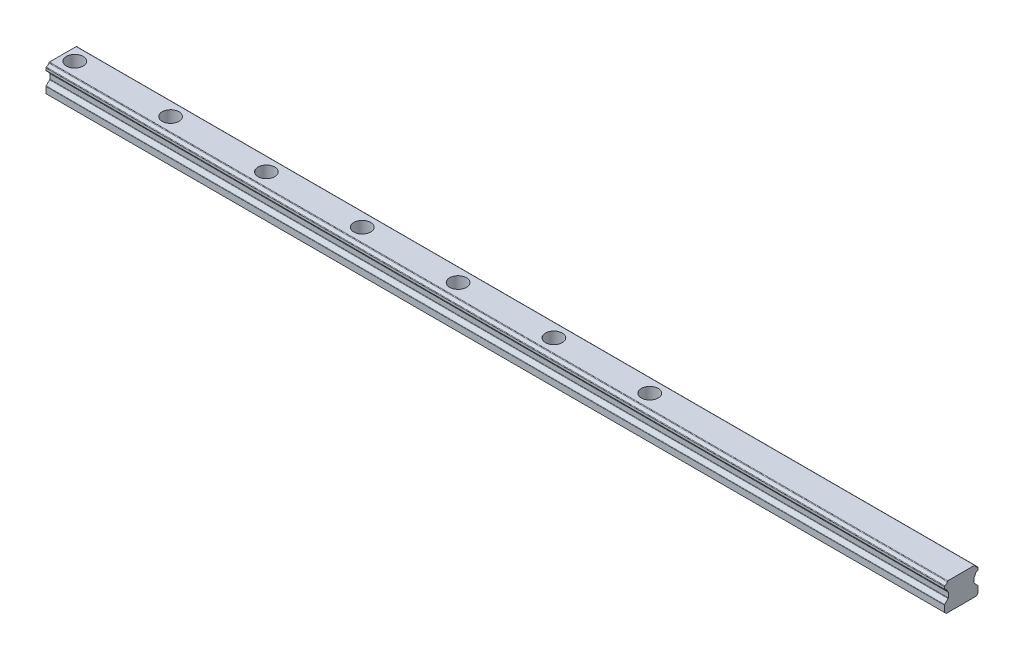
from build123d import *

# Parameters (mm, degrees)
BOSS_EXTRUDE1_DEPTH = 750


with BuildPart() as part:
    # Sketch1 → Boss-Extrude1 (new body)
    with BuildSketch(Plane(origin=(-10, 0, 0), x_dir=(0, 0, -1), z_dir=(1, 0, 0))):
        with BuildLine():
            Line((-14, 20.148439), (-14, 18.35158))
            ThreePointArc((-14, 18.35158), (-13.885407957, 18.031881418), (-13.592386868, 17.860192277))
            ThreePointArc((-13.592386868, 17.860192277), (-12.229021504, 17.099202354), (-11.602627372, 15.66899217))
            ThreePointArc((-11.602627372, 15.66899217), (-11.559004129, 15.501191683), (-11.458152391, 15.360163609))
            Line((-11.458152391, 15.360163609), (-11.005017, 14.906991))
            ThreePointArc((-11.005017, 14.906991), (-10.852063473, 14.680418582), (-10.800003, 14.412054))
            Line((-10.800003, 14.412054), (-10.800003, 10.490777069))
            ThreePointArc((-10.800003, 10.490777069), (-10.853443426, 10.222114259), (-11.005628687, 9.994352913))
            Line((-11.005628687, 9.994352913), (-13.795574427, 7.204407575))
            ThreePointArc((-13.795574427, 7.204407575), (-13.946871354, 6.977976046), (-14, 6.710881784))
            Line((-14, 6.710881784), (-14, 1.5))
            Line((-14, 1.5), (-12.5, 0))
            Line((-12.5, 0), (12.5, 0))
            Line((12.5, 0), (14, 1.5))
            Line((14, 1.5), (14, 6.710881784))
            ThreePointArc((14, 6.710881784), (13.946871354, 6.977976046), (13.795574427, 7.204407575))
            Line((13.795574427, 7.204407575), (11.005628687, 9.994352913))
            ThreePointArc((11.005628687, 9.994352913), (10.853443426, 10.222114259), (10.800003, 10.490777069))
            Line((10.800003, 10.490777069), (10.800003, 14.412054))
            ThreePointArc((10.800003, 14.412054), (10.852063473, 14.680418582), (11.005017, 14.906991))
            Line((11.005017, 14.906991), (11.458152391, 15.360163609))
            ThreePointArc((11.458152391, 15.360163609), (11.559004129, 15.501191683), (11.602627372, 15.66899217))
            ThreePointArc((11.602627372, 15.66899217), (12.229021504, 17.099202354), (13.592386868, 17.860192277))
            ThreePointArc((13.592386868, 17.860192277), (13.885407957, 18.031881418), (14, 18.35158))
            Line((14, 18.35158), (14, 20.148439))
            ThreePointArc((14, 20.148439), (13.886532321, 20.469052961), (13.5924176, 20.639829881))
            ThreePointArc((13.5924176, 20.639829881), (12.312672018, 21.314596081), (11.635789981, 22.593223817))
            ThreePointArc((11.635789981, 22.593223817), (11.466717508, 22.887148006), (11.146965482, 23))
            Line((11.146965482, 23), (-11.146965482, 23))
            ThreePointArc((-11.146965482, 23), (-11.466717508, 22.887148006), (-11.635789981, 22.593223817))
            ThreePointArc((-11.635789981, 22.593223817), (-12.312672018, 21.314596081), (-13.5924176, 20.639829881))
            ThreePointArc((-13.5924176, 20.639829881), (-13.886532321, 20.469052961), (-14, 20.148439))
        make_face()
    extrude(amount=BOSS_EXTRUDE1_DEPTH)

    # Sketch2 → Cut-Revolve1 (revolve, cut)
    with BuildSketch(Plane.XY, mode=Mode.PRIVATE) as cut_revolve1_sk:
        Polygon((0, 23), (7, 23), (7, 11), (4.5, 11), (4.5, 0), (0, 0), align=None)
    revolve(cut_revolve1_sk.sketch.rotate(Axis((0, 0, 0), (0, 1, 0)), 270), axis=Axis((0, 0, 0), (0, 1, 0)), mode=Mode.SUBTRACT)

    # Sketch3 → Cut-Revolve2 (revolve, cut)
    with BuildSketch(Plane.XY, mode=Mode.PRIVATE) as cut_revolve2_sk:
        Polygon((80, 23), (87, 23), (87, 11), (84.5, 11), (84.5, 0), (80, 0), align=None)
    revolve(cut_revolve2_sk.sketch.rotate(Axis((80, 0, 0), (0, 1, 0)), 270), axis=Axis((80, 0, 0), (0, 1, 0)), mode=Mode.SUBTRACT)

    # Sketch4 → Cut-Revolve3 (revolve, cut)
    with BuildSketch(Plane.XY, mode=Mode.PRIVATE) as cut_revolve3_sk:
        Polygon((160, 23), (167, 23), (167, 11), (164.5, 11), (164.5, 0), (160, 0), align=None)
    revolve(cut_revolve3_sk.sketch.rotate(Axis((160, 0, 0), (0, 1, 0)), 270), axis=Axis((160, 0, 0), (0, 1, 0)), mode=Mode.SUBTRACT)

    # Sketch5 → Cut-Revolve4 (revolve, cut)
    with BuildSketch(Plane.XY, mode=Mode.PRIVATE) as cut_revolve4_sk:
        Polygon((240, 23), (247, 23), (247, 11), (244.5, 11), (244.5, 0), (240, 0), align=None)
    revolve(cut_revolve4_sk.sketch.rotate(Axis((240, 0, 0), (0, 1, 0)), 270), axis=Axis((240, 0, 0), (0, 1, 0)), mode=Mode.SUBTRACT)

    # Sketch6 → Cut-Revolve5 (revolve, cut)
    with BuildSketch(Plane.XY, mode=Mode.PRIVATE) as cut_revolve5_sk:
        Polygon((320, 23), (327, 23), (327, 11), (324.5, 11), (324.5, 0), (320, 0), align=None)
    revolve(cut_revolve5_sk.sketch.rotate(Axis((320, 0, 0), (0, 1, 0)), 270), axis=Axis((320, 0, 0), (0, 1, 0)), mode=Mode.SUBTRACT)

    # Sketch7 → Cut-Revolve6 (revolve, cut)
    with BuildSketch(Plane.XY, mode=Mode.PRIVATE) as cut_revolve6_sk:
        Polygon((400, 23), (407, 23), (407, 11), (404.5, 11), (404.5, 0), (400, 0), align=None)
    revolve(cut_revolve6_sk.sketch.rotate(Axis((400, 0, 0), (0, 1, 0)), 270), axis=Axis((400, 0, 0), (0, 1, 0)), mode=Mode.SUBTRACT)

    # Sketch8 → Cut-Revolve7 (revolve, cut)
    with BuildSketch(Plane.XY, mode=Mode.PRIVATE) as cut_revolve7_sk:
        Polygon((480, 23), (487, 23), (487, 11), (484.5, 11), (484.5, 0), (480, 0), align=None)
    revolve(cut_revolve7_sk.sketch.rotate(Axis((480, 0, 0), (0, 1, 0)), 270), axis=Axis((480, 0, 0), (0, 1, 0)), mode=Mode.SUBTRACT)


solid = part.part
